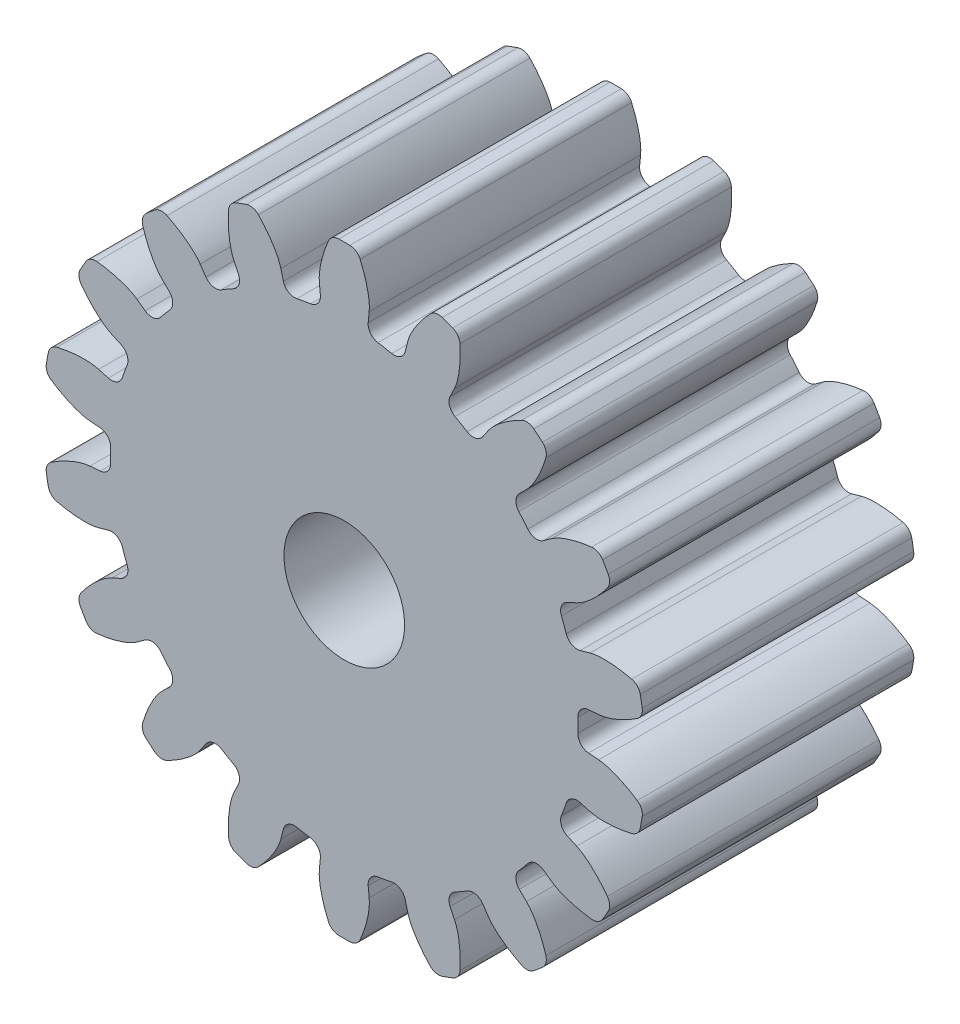
from build123d import *

# Parameters (mm, degrees)
SKETCH_1_R                       = 5
SKETCH_1_R_2                     = 1
EXTRUDE_1_DEPTH                  = 4.5
CUT_EXTRUDE_1_DEPTH              = 9.381527307
FILLET_1_R                       = 0.19
PATTERN_CIRCULAR_1_COUNT         = 18
PATTERN_CIRCULAR_1_ANGLE         = 340
FILLET_1_OF_PATTERN_CIRCULAR_1_R = 0.19


with BuildPart() as part:
    # 草图1 → 凸台-拉伸1 (new body)
    with BuildSketch(Plane.XY):
        Circle(SKETCH_1_R)
        Circle(SKETCH_1_R_2, mode=Mode.SUBTRACT)
    extrude(amount=EXTRUDE_1_DEPTH)

    # 草图1<3> → 切除-拉伸1 (cut, through all)
    with BuildSketch(Plane.XY):
        with BuildLine():
            Line((4.216167683, 0.324237649), (3.863591943, 0.297123374))
            ThreePointArc((3.863591943, 0.297123374), (3.872146935, 0.14867115), (3.875, 0))
            ThreePointArc((3.875, 0), (3.872146935, -0.14867115), (3.863591943, -0.297123374))
            Line((3.863591943, -0.297123374), (4.216167683, -0.324237649))
            add(Edge.make_bspline(
                [(4.216167683, -0.324237649), (4.248306389, -0.326709225), (4.337481239, -0.340286167), (4.502360973, -0.392611203), (4.68808741, -0.481175676), (4.835513121, -0.572403241), (4.929530291, -0.638831397), (4.956443154, -0.658537214)],
                knots=[0, 0, 0, 0, 0, 0.005604068, 0.015718248, 0.029959916, 0.035770965, 0.035770965, 0.035770965, 0.035770965, 0.035770965], degree=4))
            ThreePointArc((4.956443154, -0.658537214), (4.989098905, -0.329988053), (5, 0))
            ThreePointArc((5, 0), (4.989098905, 0.329988053), (4.956443154, 0.658537214))
            add(Edge.make_bspline(
                [(4.216167683, 0.324237649), (4.248306389, 0.326709225), (4.337481239, 0.340286167), (4.502360973, 0.392611203), (4.68808741, 0.481175676), (4.835513121, 0.572403241), (4.929530291, 0.638831397), (4.956443154, 0.658537214)],
                knots=[0, 0, 0, 0, 0, 0.005604068, 0.015718248, 0.029959916, 0.035770965, 0.035770965, 0.035770965, 0.035770965, 0.035770965], degree=4))
        make_face()
    cut_extrude_1 = extrude(amount=CUT_EXTRUDE_1_DEPTH, mode=Mode.SUBTRACT)

    # 圆角1
    fillet_1_edges = [part.edges().sort_by_distance(p)[0] for p in [
        (4.956443154, 0.658537214, 2.25),
        (4.956443154, -0.658537214, 2.25),
        (3.863591943, 0.297123374, 2.25),
        (3.863591943, -0.297123374, 2.25),
    ]]
    fillet(fillet_1_edges, radius=FILLET_1_R)

    # 阵列(圆周)1: 切除-拉伸1 ×18 about axis
    pattern_circular_1_axis = Axis((0, 0, 4.5), (0, 0, 1))
    for i in range(1, PATTERN_CIRCULAR_1_COUNT):
        add(cut_extrude_1.rotate(pattern_circular_1_axis, i * PATTERN_CIRCULAR_1_ANGLE / (PATTERN_CIRCULAR_1_COUNT - 1)), mode=Mode.SUBTRACT)

    # 圆角1 of 阵列(圆周)1
    fillet_1_of_pattern_circular_1_edges = [part.edges().sort_by_distance(p)[0] for p in [
        (4.432300065, 2.314025958, 2.25),
        (4.882766049, 1.076380838, 2.25),
        (3.528966659, 1.600630912, 2.25),
        (3.732211017, 1.042221628, 2.25),
        (3.373556174, 3.690409021, 2.25),
        (4.220155297, 2.681471474, 2.25),
        (2.768695915, 2.711078739, 2.25),
        (3.150670362, 2.25585932, 2.25),
        (1.907911621, 4.621674291, 2.25),
        (3.048531533, 3.963137077, 2.25),
        (1.674479581, 3.494530459, 2.25),
        (2.189112361, 3.197407085, 2.25),
        (0.212144768, 4.995497432, 2.25),
        (1.509209875, 4.766789858, 2.25),
        (0.378296298, 3.856490232, 2.25),
        (0.963515103, 3.753300367, 2.25),
        (-1.509209875, 4.766789858, 2.25),
        (-0.212144768, 4.995497432, 2.25),
        (-0.963515103, 3.753300367, 2.25),
        (-0.378296298, 3.856490232, 2.25),
        (-3.048531533, 3.963137077, 2.25),
        (-1.907911621, 4.621674291, 2.25),
        (-2.189112361, 3.197407085, 2.25),
        (-1.674479581, 3.494530459, 2.25),
        (-4.220155297, 2.681471474, 2.25),
        (-3.373556174, 3.690409021, 2.25),
        (-3.150670362, 2.25585932, 2.25),
        (-2.768695915, 2.711078739, 2.25),
        (-4.882766049, 1.076380838, 2.25),
        (-4.432300065, 2.314025958, 2.25),
        (-3.732211017, 1.042221628, 2.25),
        (-3.528966659, 1.600630912, 2.25),
        (-4.956443154, -0.658537214, 2.25),
        (-4.956443154, 0.658537214, 2.25),
        (-3.863591943, -0.297123374, 2.25),
        (-3.863591943, 0.297123374, 2.25),
        (-4.432300065, -2.314025958, 2.25),
        (-4.882766049, -1.076380838, 2.25),
        (-3.528966659, -1.600630912, 2.25),
        (-3.732211017, -1.042221628, 2.25),
        (-3.373556174, -3.690409021, 2.25),
        (-4.220155297, -2.681471474, 2.25),
        (-2.768695915, -2.711078739, 2.25),
        (-3.150670362, -2.25585932, 2.25),
        (-1.907911621, -4.621674291, 2.25),
        (-3.048531533, -3.963137077, 2.25),
        (-1.674479581, -3.494530459, 2.25),
        (-2.189112361, -3.197407085, 2.25),
        (-0.212144768, -4.995497432, 2.25),
        (-1.509209875, -4.766789858, 2.25),
        (-0.378296298, -3.856490232, 2.25),
        (-0.963515103, -3.753300367, 2.25),
        (1.509209875, -4.766789858, 2.25),
        (0.212144768, -4.995497432, 2.25),
        (0.963515103, -3.753300367, 2.25),
        (0.378296298, -3.856490232, 2.25),
        (3.048531533, -3.963137077, 2.25),
        (1.907911621, -4.621674291, 2.25),
        (2.189112361, -3.197407085, 2.25),
        (1.674479581, -3.494530459, 2.25),
        (4.220155297, -2.681471474, 2.25),
        (3.373556174, -3.690409021, 2.25),
        (3.150670362, -2.25585932, 2.25),
        (2.768695915, -2.711078739, 2.25),
        (4.882766049, -1.076380838, 2.25),
        (4.432300065, -2.314025958, 2.25),
        (3.732211017, -1.042221628, 2.25),
        (3.528966659, -1.600630912, 2.25),
    ]]
    fillet(fillet_1_of_pattern_circular_1_edges, radius=FILLET_1_OF_PATTERN_CIRCULAR_1_R)


solid = part.part
